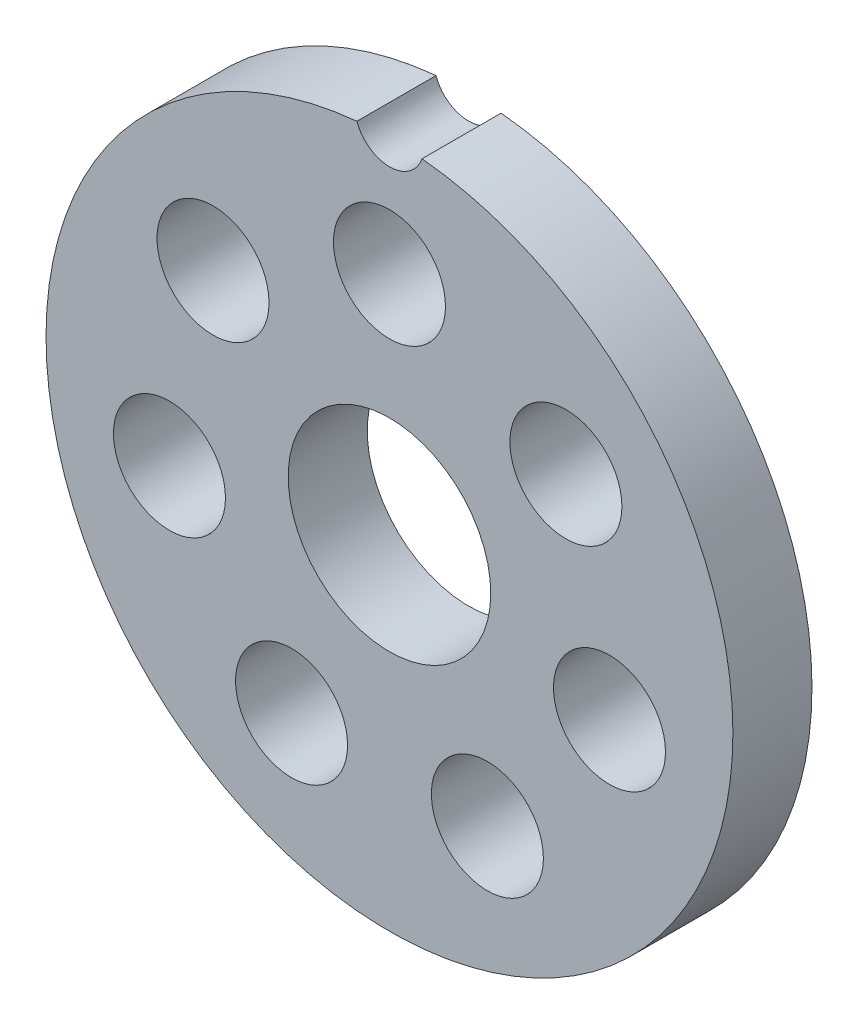
from build123d import *

# Parameters (mm, degrees)
SKETCH1_R           = 1.7272
SKETCH1_R_2         = 3.1242
BOSS_EXTRUDE1_DEPTH = 2.4384


with BuildPart() as part:
    # Sketch1 → Boss-Extrude1 (new body)
    with BuildSketch(Plane.XY):
        with BuildLine():
            ThreePointArc((-1.0033, 10.544174522), (0, -10.5918), (1.0033, 10.544174522))
            ThreePointArc((1.0033, 10.544174522), (0, 9.8298), (-1.0033, 10.544174522))
        make_face()
        with Locations((0, 6.9596)):
            Circle(SKETCH1_R, mode=Mode.SUBTRACT)
        with Locations((-5.441234385, 4.339239625)):
            Circle(SKETCH1_R, mode=Mode.SUBTRACT)
        with Locations((-6.785108298, -1.548656692)):
            Circle(SKETCH1_R, mode=Mode.SUBTRACT)
        with Locations((-3.019657271, -6.270382933)):
            Circle(SKETCH1_R, mode=Mode.SUBTRACT)
        with Locations((3.019657271, -6.270382933)):
            Circle(SKETCH1_R, mode=Mode.SUBTRACT)
        with Locations((6.785108298, -1.548656692)):
            Circle(SKETCH1_R, mode=Mode.SUBTRACT)
        with Locations((5.441234385, 4.339239625)):
            Circle(SKETCH1_R, mode=Mode.SUBTRACT)
        Circle(SKETCH1_R_2, mode=Mode.SUBTRACT)
    extrude(amount=BOSS_EXTRUDE1_DEPTH)


solid = part.part
